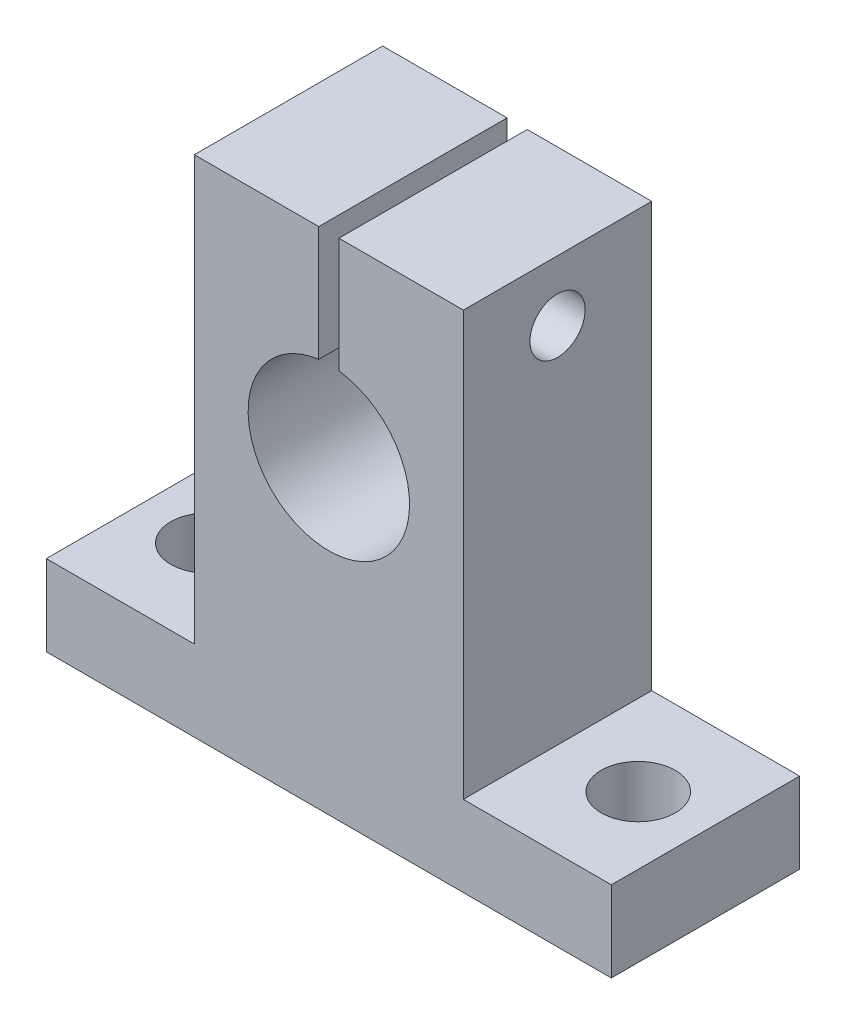
from build123d import *

# Parameters (mm, degrees)
BOSS_EXTRUDE1_DEPTH = 7
SKETCH2_R           = 6
CUT_EXTRUDE1_DEPTH  = 46.202322949
SKETCH3_R           = 2.05
CUT_EXTRUDE2_DEPTH  = 50.155365933
SKETCH4_R           = 2.75
CUT_EXTRUDE3_DEPTH  = 14
SKETCH5_W           = 1.5
SKETCH5_H           = 29
CUT_EXTRUDE4_DEPTH  = 46.202322949


with BuildPart() as part:
    # Sketch1 → Boss-Extrude1 (new, symmetric)
    with BuildSketch(Plane.XY):
        Polygon((0, 0), (21, 0), (21, 6), (10, 6), (10, 37.5), (0, 37.5), align=None)
    boss_extrude1 = extrude(amount=BOSS_EXTRUDE1_DEPTH, both=True)

    # Mirror1: Boss-Extrude1 across plane
    add(boss_extrude1.mirror(Plane(origin=(0, 37.5, 7), x_dir=(0, 0, 1), z_dir=(1, 0, 0))))

    # Sketch2 → Cut-Extrude1 (cut, through all)
    with BuildSketch(Plane.XY.offset(7)):
        with Locations((0, 23)):
            Circle(SKETCH2_R)
    extrude(amount=-CUT_EXTRUDE1_DEPTH, mode=Mode.SUBTRACT)

    # Sketch3 → Cut-Extrude2 (cut, through all)
    with BuildSketch(Plane(origin=(10, 0, 0), x_dir=(0, 0, -1), z_dir=(1, 0, 0))):
        with Locations((0, 33)):
            Circle(SKETCH3_R)
    extrude(amount=-CUT_EXTRUDE2_DEPTH, mode=Mode.SUBTRACT)

    # Sketch4 → Cut-Extrude3 (cut)
    with BuildSketch(Plane(origin=(0, 6, 0), x_dir=(1, 0, 0), z_dir=(0, 1, 0))):
        with Locations(Location((-16, 0, 0), (0, 0, 180))):
            Circle(SKETCH4_R)
        with Locations(Location((16, 0, 0), (0, 0, 180))):
            Circle(SKETCH4_R)
    extrude(amount=-CUT_EXTRUDE3_DEPTH, mode=Mode.SUBTRACT)

    # Sketch5 → Cut-Extrude4 (cut, through all)
    with BuildSketch(Plane.XY.offset(7)):
        with Locations((0, 37.5)):
            Rectangle(SKETCH5_W, SKETCH5_H)
    extrude(amount=-CUT_EXTRUDE4_DEPTH, mode=Mode.SUBTRACT)


solid = part.part
